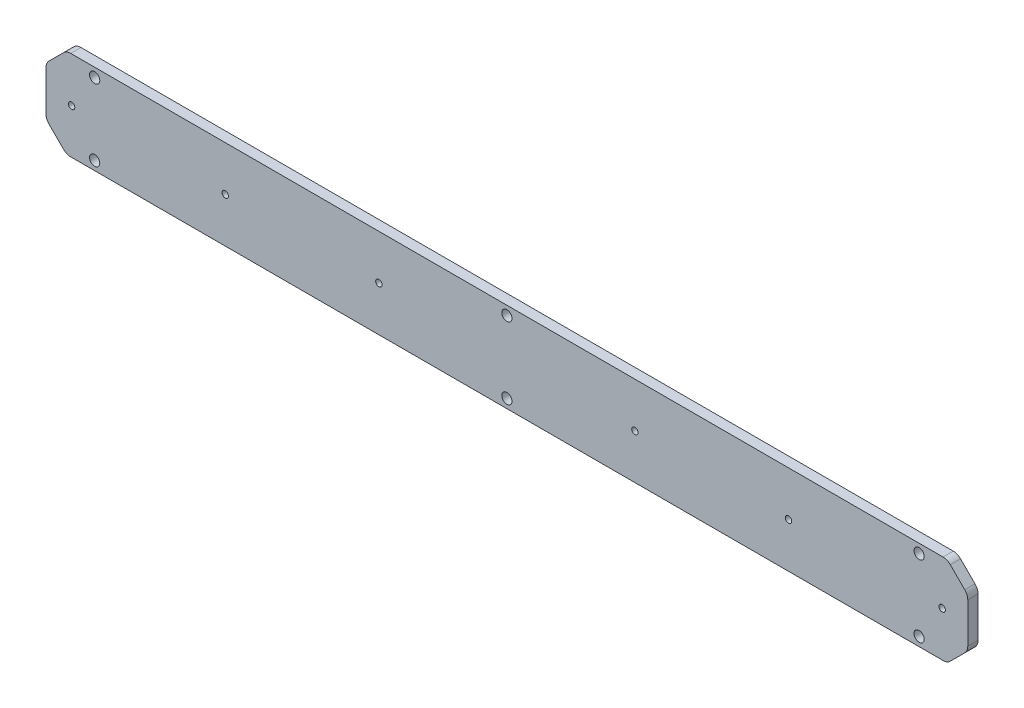
from build123d import *

# Parameters (mm, degrees)
CROQUIS1_W              = 360
CROQUIS1_H              = 35
SALIENTE_EXTRUIR1_DEPTH = 4
CROQUIS2_R              = 2
CORTAR_EXTRUIR1_DEPTH   = 5
TALADRO_ROSCADO_M31_D   = 2.5
CHAFL_N1_SIZE           = 8
REDONDEO2_R             = 4


with BuildPart() as part:
    # Croquis1 → Saliente-Extruir1 (new body)
    with BuildSketch(Plane.XY):
        Rectangle(CROQUIS1_W, CROQUIS1_H)
    extrude(amount=SALIENTE_EXTRUIR1_DEPTH)

    # Croquis2 → Cortar-Extruir1 (cut)
    with BuildSketch(Plane.XY.offset(4)):
        with Locations((0, 14)):
            Circle(CROQUIS2_R)
        with Locations((0, -14)):
            Circle(CROQUIS2_R)
        with Locations((161, 14)):
            Circle(CROQUIS2_R)
        with Locations((161, -14)):
            Circle(CROQUIS2_R)
        with Locations((-161, 14)):
            Circle(CROQUIS2_R)
        with Locations((-161, -14)):
            Circle(CROQUIS2_R)
    extrude(amount=-CORTAR_EXTRUIR1_DEPTH, mode=Mode.SUBTRACT)

    # Taladro roscado M31 (through all)
    with Locations(Plane.XY.offset(4)):
        with Locations((-170, 0), (-110, 0), (-50, 0), (50, 0), (110, 0), (170, 0)):
            Hole(TALADRO_ROSCADO_M31_D / 2)

    # Chaflán1
    chafl_n1_edges = [part.edges().sort_by_distance(p)[0] for p in [
        (180, -17.5, 2),
        (-180, -17.5, 2),
        (-180, 17.5, 2),
        (180, 17.5, 2),
    ]]
    chamfer(chafl_n1_edges, length=CHAFL_N1_SIZE)

    # Redondeo2
    redondeo2_edges = [part.edges().sort_by_distance(p)[0] for p in [
        (180, 9.5, 2),
        (180, -9.5, 2),
        (-172, -17.5, 2),
        (172, -17.5, 2),
        (-172, 17.5, 2),
        (172, 17.5, 2),
        (-180, 9.5, 2),
        (-180, -9.5, 2),
    ]]
    fillet(redondeo2_edges, radius=REDONDEO2_R)


solid = part.part
